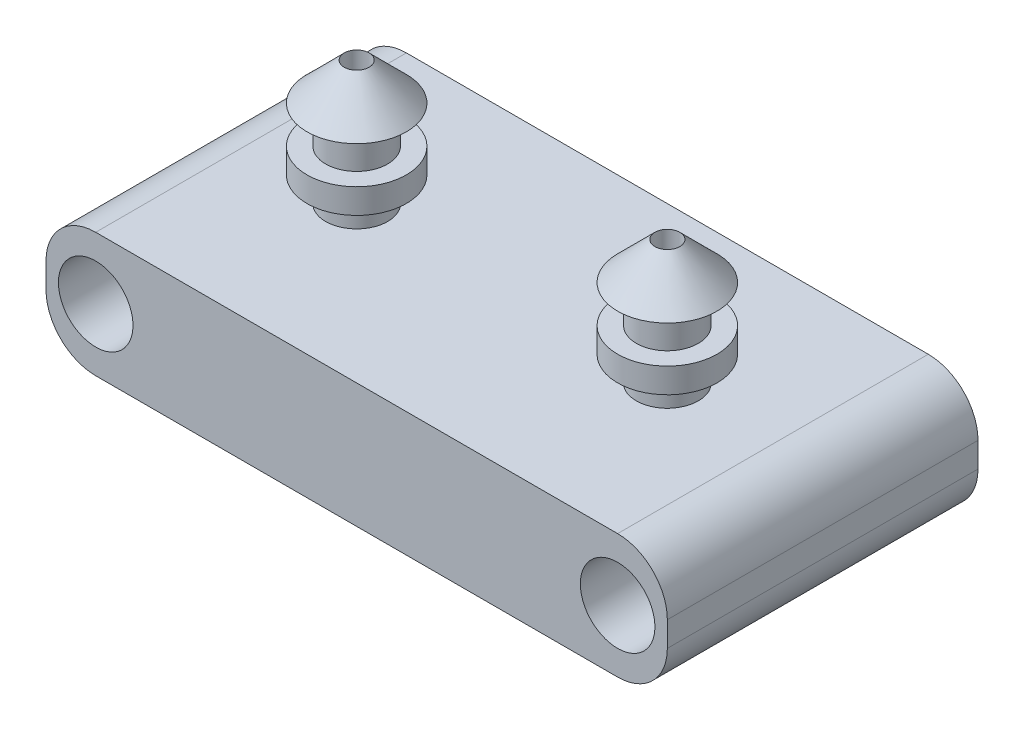
from build123d import *

# Parameters (mm, degrees)
SKETCH1_W           = 25
SKETCH1_H           = 12.5
BOSS_EXTRUDE1_DEPTH = 5
FILLET1_R           = 2
SKETCH4_R           = 1.5
CUT_EXTRUDE1_DEPTH  = 21.310096012
SKETCH5_W           = 17
SKETCH5_H           = 8.5
CUT_EXTRUDE2_DEPTH  = 2.5
BOSS_EXTRUDE2_DEPTH = 5


with BuildPart() as part:
    # Sketch1 → Boss-Extrude1 (new body)
    with BuildSketch(Plane(origin=(0, 0, 0), x_dir=(1, 0, 0), z_dir=(0, 1, 0))):
        Rectangle(SKETCH1_W, SKETCH1_H)
    extrude(amount=BOSS_EXTRUDE1_DEPTH)

    # Sketch3 → Revolve1 (revolve)
    with BuildSketch(Plane.XY):
        Polygon((-6.75, 5), (-7.5, 5), (-7.5, 6), (-8.25, 6), (-8.25, 7), (-7.495786155, 7), (-7.495786155, 8.5), (-8.25, 8.5), (-6.75, 10), align=None)
    revolve1 = revolve(axis=Axis((-6.25, 11.553372133, 0), (0, -1, 0)))

    # Fillet1
    fillet1_edges = [part.edges().sort_by_distance(p)[0] for p in [
        (12.5, 5, 0),
        (-12.5, 5, 0),
        (12.5, 0, 0),
        (-12.5, 0, 0),
    ]]
    fillet(fillet1_edges, radius=FILLET1_R)

    # Sketch4 → Cut-Extrude1 (cut, through all)
    with BuildSketch(Plane(origin=(0, 0, -6.25), x_dir=(-1, 0, 0), z_dir=(0, 0, -1))):
        with Locations((10.5, 2.5)):
            Circle(SKETCH4_R)
        with Locations((-10.5, 2.5)):
            Circle(SKETCH4_R)
    extrude(amount=-CUT_EXTRUDE1_DEPTH, mode=Mode.SUBTRACT)

    # Mirror1: Revolve1 across plane
    add(revolve1.mirror(Plane(origin=(0, 0, 0), x_dir=(0, 0, 1), z_dir=(1, 0, 0))))

    # Sketch5 → Cut-Extrude2 (cut)
    with BuildSketch(Plane.XZ):
        Rectangle(SKETCH5_W, SKETCH5_H)
    extrude(amount=-CUT_EXTRUDE2_DEPTH, mode=Mode.SUBTRACT)

    # Sketch6 → Boss-Extrude2 (add)
    with BuildSketch(Plane.XZ.offset(-2.5)):
        with BuildLine():
            Line((0.5, 0.15), (0.5, 0.85))
            ThreePointArc((0.5, 0.85), (0.543933983, 0.956066017), (0.65, 1))
            Line((0.65, 1), (1.35, 1))
            ThreePointArc((1.35, 1), (1.456066017, 0.956066017), (1.5, 0.85))
            Line((1.5, 0.85), (1.5, 0.15))
            ThreePointArc((1.5, 0.15), (1.456066017, 0.043933983), (1.35, 0))
            Line((1.35, 0), (0.65, 0))
            ThreePointArc((0.65, 0), (0.543933983, 0.043933983), (0.5, 0.15))
        make_face()
        with BuildLine():
            Line((2.65, 0), (3.35, 0))
            ThreePointArc((3.35, 0), (3.456066017, 0.043933983), (3.5, 0.15))
            Line((3.5, 0.15), (3.5, 0.85))
            ThreePointArc((3.5, 0.85), (3.456066017, 0.956066017), (3.35, 1))
            Line((3.35, 1), (2.65, 1))
            ThreePointArc((2.65, 1), (2.543933983, 0.956066017), (2.5, 0.85))
            Line((2.5, 0.85), (2.5, 0.15))
            ThreePointArc((2.5, 0.15), (2.543933983, 0.043933983), (2.65, 0))
        make_face()
        with BuildLine():
            Line((-1.5, 0.15), (-1.5, 0.85))
            ThreePointArc((-1.5, 0.85), (-1.456066017, 0.956066017), (-1.35, 1))
            Line((-1.35, 1), (-0.65, 1))
            ThreePointArc((-0.65, 1), (-0.543933983, 0.956066017), (-0.5, 0.85))
            Line((-0.5, 0.85), (-0.5, 0.15))
            ThreePointArc((-0.5, 0.15), (-0.543933983, 0.043933983), (-0.65, 0))
            Line((-0.65, 0), (-1.35, 0))
            ThreePointArc((-1.35, 0), (-1.456066017, 0.043933983), (-1.5, 0.15))
        make_face()
        with BuildLine():
            Line((-3.5, 0.15), (-3.5, 0.85))
            ThreePointArc((-3.5, 0.85), (-3.456066017, 0.956066017), (-3.35, 1))
            Line((-3.35, 1), (-2.65, 1))
            ThreePointArc((-2.65, 1), (-2.543933983, 0.956066017), (-2.5, 0.85))
            Line((-2.5, 0.85), (-2.5, 0.15))
            ThreePointArc((-2.5, 0.15), (-2.543933983, 0.043933983), (-2.65, 0))
            Line((-2.65, 0), (-3.35, 0))
            ThreePointArc((-3.35, 0), (-3.456066017, 0.043933983), (-3.5, 0.15))
        make_face()
    extrude(amount=BOSS_EXTRUDE2_DEPTH)


solid = part.part
